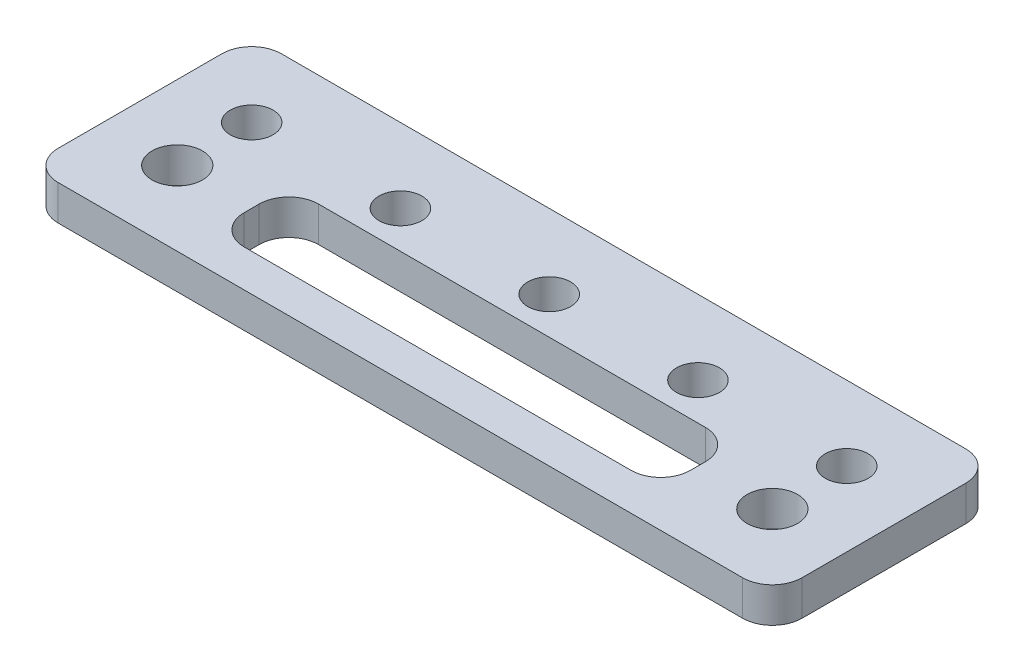
from build123d import *

# Parameters (mm, degrees)
SKETCH1_W             = 63.5
SKETCH1_H             = 19.05
BOSS_EXTRUDE1_DEPTH   = 3
F_6_CLEARANCE_HOLE1_D = 3.6576
F_8_CLEARANCE_HOLE1_D = 4.3053
FILLET1_R             = 2.54
CUT_EXTRUDE1_DEPTH    = 34.283451218


with BuildPart() as part:
    # Sketch1 → Boss-Extrude1 (new body)
    with BuildSketch(Plane(origin=(0, 0, 0), x_dir=(1, 0, 0), z_dir=(0, 1, 0))):
        Rectangle(SKETCH1_W, SKETCH1_H)
    extrude(amount=BOSS_EXTRUDE1_DEPTH)

    # #6 Clearance Hole1 (through all)
    with Locations(Plane(origin=(0, 3, 0), x_dir=(1, 0, 0), z_dir=(0, 1, 0))):
        with Locations((-25.4, 3.175), (0, 3.175), (25.4, 3.175), (12.7, 3.175), (-12.7, 3.175)):
            Hole(F_6_CLEARANCE_HOLE1_D / 2)

    # #8 Clearance Hole1 (through all)
    with Locations(Plane(origin=(0, 3, 0), x_dir=(1, 0, 0), z_dir=(0, 1, 0))):
        with Locations((-25.4, -3.175), (25.4, -3.175)):
            Hole(F_8_CLEARANCE_HOLE1_D / 2)

    # Fillet1
    fillet1_edges = [part.edges().sort_by_distance(p)[0] for p in [
        (-31.75, 1.5, -9.525),
        (31.75, 1.5, -9.525),
        (31.75, 1.5, 9.525),
        (-31.75, 1.5, 9.525),
    ]]
    fillet(fillet1_edges, radius=FILLET1_R)

    # Sketch8 → Cut-Extrude1 (cut, through all)
    with BuildSketch(Plane(origin=(0, 3, 0), x_dir=(1, 0, 0), z_dir=(0, 1, 0))):
        with BuildLine():
            Line((16.51, -6.35), (-16.51, -6.35))
            ThreePointArc((-16.51, -6.35), (-18.306051224, -5.606051224), (-19.05, -3.81))
            Line((-19.05, -3.81), (-19.05, -2.54))
            ThreePointArc((-19.05, -2.54), (-18.306051224, -0.743948776), (-16.51, 0))
            Line((-16.51, 0), (16.51, 0))
            ThreePointArc((16.51, 0), (18.306051224, -0.743948776), (19.05, -2.54))
            Line((19.05, -2.54), (19.05, -3.81))
            ThreePointArc((19.05, -3.81), (18.306051224, -5.606051224), (16.51, -6.35))
        make_face()
    extrude(amount=-CUT_EXTRUDE1_DEPTH, mode=Mode.SUBTRACT)


solid = part.part
